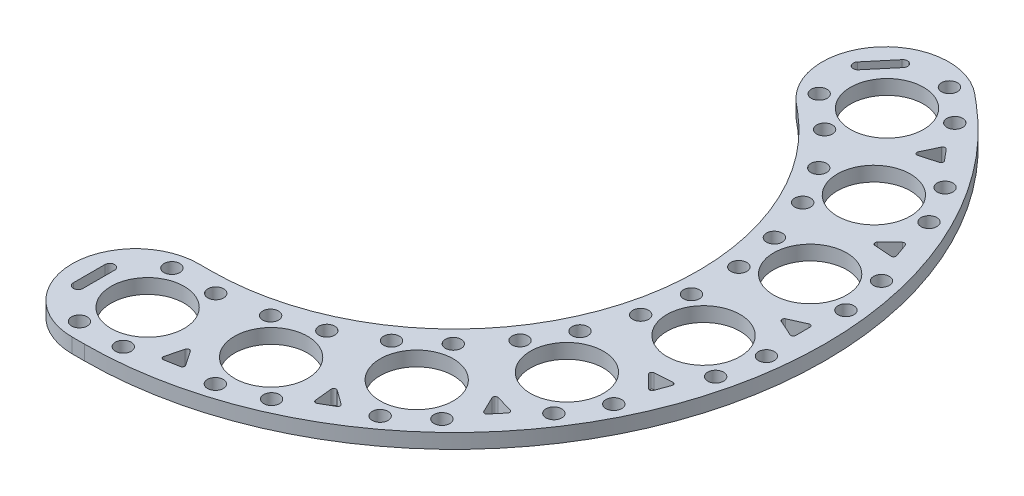
from build123d import *

# Parameters (mm, degrees)
SKETCH1_R           = 150
SKETCH1_R_2         = 32.5
BOSS_EXTRUDE1_DEPTH = 60


with BuildPart() as part:
    # Sketch1 → Boss-Extrude1 (new body)
    with BuildSketch(Plane(origin=(0, 0, 0), x_dir=(1, 0, 0), z_dir=(0, 1, 0))):
        with BuildLine():
            Line((642.787609687, 766.044443119), (604.485387531, 798.183823603))
            ThreePointArc((604.485387531, 798.183823603), (572.438610838, 1164.480157333), (938.734944568, 1196.526934025))
            Line((938.734944568, 1196.526934025), (977.037166724, 1164.387553541))
            ThreePointArc((977.037166724, 1164.387553541), (1428.332783595, -519.870617855), (0, -1520))
            Line((0, -1520), (-50, -1520))
            ThreePointArc((-50, -1520), (-310, -1260), (-50, -1000))
            Line((-50, -1000), (0, -1000))
            ThreePointArc((0, -1000), (939.692620786, -342.020143326), (642.787609687, 766.044443119))
        make_face()
        with Locations(Location((0, -1260, 0), (0, 0, 270))):
            Circle(SKETCH1_R, mode=Mode.SUBTRACT)
        with Locations(Location((90, -1070.26334039, 0), (0, 0, 270))):
            Circle(SKETCH1_R_2, mode=Mode.SUBTRACT)
        with Locations(Location((-90, -1070.26334039, 0), (0, 0, 90))):
            Circle(SKETCH1_R_2, mode=Mode.SUBTRACT)
        with Locations(Location((-90, -1449.73665961, 0), (0, 0, 270))):
            Circle(SKETCH1_R_2, mode=Mode.SUBTRACT)
        with Locations(Location((90, -1449.73665961, 0), (0, 0, 90))):
            Circle(SKETCH1_R_2, mode=Mode.SUBTRACT)
        with Locations(Location((450.623956947, -974.936750363, 0), (0, 0, 270))):
            Circle(SKETCH1_R_2, mode=Mode.SUBTRACT)
        with Locations(Location((430.94538059, -1184.01270219, 0), (0, 0, 270))):
            Circle(SKETCH1_R, mode=Mode.SUBTRACT)
        with Locations(Location((281.479285206, -1036.500376161, 0), (0, 0, 90))):
            Circle(SKETCH1_R_2, mode=Mode.SUBTRACT)
        with Locations(Location((580.411475975, -1331.525028219, 0), (0, 0, 90))):
            Circle(SKETCH1_R_2, mode=Mode.SUBTRACT)
        with Locations(Location((411.266804234, -1393.088654018, 0), (0, 0, 270))):
            Circle(SKETCH1_R_2, mode=Mode.SUBTRACT)
        with Locations(Location((756.896014185, -762.018399708, 0), (0, 0, 270))):
            Circle(SKETCH1_R_2, mode=Mode.SUBTRACT)
        with Locations(Location((809.912388205, -965.21599833, 0), (0, 0, 270))):
            Circle(SKETCH1_R, mode=Mode.SUBTRACT)
        with Locations(Location((619.008014424, -877.720169451, 0), (0, 0, 90))):
            Circle(SKETCH1_R_2, mode=Mode.SUBTRACT)
        with Locations(Location((1000.816761986, -1052.711827208, 0), (0, 0, 90))):
            Circle(SKETCH1_R_2, mode=Mode.SUBTRACT)
        with Locations(Location((862.928762225, -1168.413596952, 0), (0, 0, 270))):
            Circle(SKETCH1_R_2, mode=Mode.SUBTRACT)
        with Locations(Location((971.875241517, -457.189383854, 0), (0, 0, 270))):
            Circle(SKETCH1_R_2, mode=Mode.SUBTRACT)
        with Locations(Location((1091.192008768, -630, 0), (0, 0, 270))):
            Circle(SKETCH1_R, mode=Mode.SUBTRACT)
        with Locations(Location((881.875241517, -613.073956536, 0), (0, 0, 90))):
            Circle(SKETCH1_R_2, mode=Mode.SUBTRACT)
        with Locations(Location((1300.50877602, -646.926043464, 0), (0, 0, 90))):
            Circle(SKETCH1_R_2, mode=Mode.SUBTRACT)
        with Locations(Location((1210.50877602, -802.810616146, 0), (0, 0, 270))):
            Circle(SKETCH1_R_2, mode=Mode.SUBTRACT)
        with Locations(Location((1069.631971371, -97.216580911, 0), (0, 0, 270))):
            Circle(SKETCH1_R_2, mode=Mode.SUBTRACT)
        with Locations(Location((1240.857768795, -218.79670386, 0), (0, 0, 270))):
            Circle(SKETCH1_R, mode=Mode.SUBTRACT)
        with Locations(Location((1038.375299391, -274.481976454, 0), (0, 0, 90))):
            Circle(SKETCH1_R_2, mode=Mode.SUBTRACT)
        with Locations(Location((1443.3402382, -163.111431267, 0), (0, 0, 90))):
            Circle(SKETCH1_R_2, mode=Mode.SUBTRACT)
        with Locations(Location((1412.08356622, -340.376826809, 0), (0, 0, 270))):
            Circle(SKETCH1_R_2, mode=Mode.SUBTRACT)
        with Locations(Location((1038.375299391, 274.481976454, 0), (0, 0, 270))):
            Circle(SKETCH1_R_2, mode=Mode.SUBTRACT)
        with Locations(Location((1240.857768795, 218.79670386, 0), (0, 0, 270))):
            Circle(SKETCH1_R, mode=Mode.SUBTRACT)
        with Locations(Location((1069.631971371, 97.216580911, 0), (0, 0, 90))):
            Circle(SKETCH1_R_2, mode=Mode.SUBTRACT)
        with Locations(Location((1412.08356622, 340.376826809, 0), (0, 0, 90))):
            Circle(SKETCH1_R_2, mode=Mode.SUBTRACT)
        with Locations(Location((1443.3402382, 163.111431267, 0), (0, 0, 270))):
            Circle(SKETCH1_R_2, mode=Mode.SUBTRACT)
        with Locations(Location((881.875241517, 613.073956536, 0), (0, 0, 270))):
            Circle(SKETCH1_R_2, mode=Mode.SUBTRACT)
        with Locations(Location((1091.192008768, 630, 0), (0, 0, 270))):
            Circle(SKETCH1_R, mode=Mode.SUBTRACT)
        with Locations(Location((971.875241517, 457.189383854, 0), (0, 0, 90))):
            Circle(SKETCH1_R_2, mode=Mode.SUBTRACT)
        with Locations(Location((1210.50877602, 802.810616146, 0), (0, 0, 90))):
            Circle(SKETCH1_R_2, mode=Mode.SUBTRACT)
        with Locations(Location((1300.50877602, 646.926043464, 0), (0, 0, 270))):
            Circle(SKETCH1_R_2, mode=Mode.SUBTRACT)
        with Locations(Location((619.008014424, 877.720169451, 0), (0, 0, 270))):
            Circle(SKETCH1_R_2, mode=Mode.SUBTRACT)
        with Locations(Location((809.912388205, 965.21599833, 0), (0, 0, 270))):
            Circle(SKETCH1_R, mode=Mode.SUBTRACT)
        with Locations(Location((756.896014185, 762.018399708, 0), (0, 0, 90))):
            Circle(SKETCH1_R_2, mode=Mode.SUBTRACT)
        with Locations(Location((862.928762225, 1168.413596952, 0), (0, 0, 90))):
            Circle(SKETCH1_R_2, mode=Mode.SUBTRACT)
        with Locations(Location((1000.816761986, 1052.711827208, 0), (0, 0, 270))):
            Circle(SKETCH1_R_2, mode=Mode.SUBTRACT)
        with BuildLine():
            Line((584.280527227, 1069.692135852), (667.842916486, 1169.277913457))
            ThreePointArc((667.842916486, 1169.277913457), (696.019557542, 1171.743050126), (698.484694211, 1143.56640907))
            Line((698.484694211, 1143.56640907), (614.922304952, 1043.980631464))
            ThreePointArc((614.922304952, 1043.980631464), (586.745663896, 1041.515494796), (584.280527227, 1069.692135852))
        make_face(mode=Mode.SUBTRACT)
        with BuildLine():
            Line((-200, -1195), (-200, -1325))
            ThreePointArc((-200, -1325), (-220, -1345), (-240, -1325))
            Line((-240, -1325), (-240, -1195))
            ThreePointArc((-240, -1195), (-220, -1175), (-200, -1195))
        make_face(mode=Mode.SUBTRACT)
        with BuildLine():
            Line((1076.459371898, 941.810748669), (1114.427735422, 896.561815035))
            ThreePointArc((1114.427735422, 896.561815035), (1116.324508918, 887.191221571), (1109.485433629, 880.510441621))
            Line((1109.485433629, 880.510441621), (1040.22465894, 860.947837857))
            ThreePointArc((1040.22465894, 860.947837857), (1029.846071871, 864.143459076), (1028.50122205, 874.919285889))
            Line((1028.50122205, 874.919285889), (1059.793633215, 939.730823288))
            ThreePointArc((1059.793633215, 939.730823288), (1067.560510066, 945.305892392), (1076.459371898, 941.810748669))
        make_face(mode=Mode.SUBTRACT)
        with BuildLine():
            Line((1265.715028387, 470.387061357), (1317.287127556, 520.587349841))
            ThreePointArc((1317.287127556, 520.587349841), (1326.492390354, 523.169772804), (1333.659175594, 516.84182204))
            Line((1333.659175594, 516.84182204), (1353.861719854, 461.335787871))
            ThreePointArc((1353.861719854, 461.335787871), (1352.439172191, 451.881575599), (1343.727582294, 447.942797489))
            Line((1343.727582294, 447.942797489), (1271.952938865, 453.248543174))
            ThreePointArc((1271.952938865, 453.248543174), (1263.29322401, 459.80113069), (1265.715028387, 470.387061357))
        make_face(mode=Mode.SUBTRACT)
        with BuildLine():
            Line((1350.264922337, 9.119215052), (1415.896353227, 38.653358952))
            ThreePointArc((1415.896353227, 38.653358952), (1425.429711423, 37.931657453), (1430, 29.5341439))
            Line((1430, 29.5341439), (1430, -29.5341439))
            ThreePointArc((1430, -29.5341439), (1425.429711423, -37.931657453), (1415.896353227, -38.653358952))
            Line((1415.896353227, -38.653358952), (1350.264922337, -9.119215052))
            ThreePointArc((1350.264922337, -9.119215052), (1344.368569111, 0), (1350.264922337, 9.119215052))
        make_face(mode=Mode.SUBTRACT)
        with BuildLine():
            Line((1271.952938865, -453.248543174), (1343.727582294, -447.942797489))
            ThreePointArc((1343.727582294, -447.942797489), (1352.439172192, -451.881575599), (1353.861719854, -461.335787871))
            Line((1353.861719854, -461.335787871), (1333.659175594, -516.84182204))
            ThreePointArc((1333.659175594, -516.84182204), (1326.492390354, -523.169772804), (1317.287127556, -520.587349841))
            Line((1317.287127556, -520.587349841), (1265.715028387, -470.387061357))
            ThreePointArc((1265.715028387, -470.387061357), (1263.29322401, -459.80113069), (1271.952938865, -453.248543174))
        make_face(mode=Mode.SUBTRACT)
        with BuildLine():
            Line((1040.22465894, -860.947837857), (1109.485433629, -880.510441621))
            ThreePointArc((1109.485433629, -880.510441621), (1116.324508918, -887.191221571), (1114.427735422, -896.561815035))
            Line((1114.427735422, -896.561815035), (1076.459371898, -941.810748669))
            ThreePointArc((1076.459371898, -941.810748669), (1067.560510067, -945.305892392), (1059.793633215, -939.730823288))
            Line((1059.793633215, -939.730823288), (1028.50122205, -874.919285889))
            ThreePointArc((1028.50122205, -874.919285889), (1029.846071871, -864.143459076), (1040.22465894, -860.947837857))
        make_face(mode=Mode.SUBTRACT)
        with BuildLine():
            Line((683.029933066, -1164.804117057), (741.422967407, -1206.875531544))
            ThreePointArc((741.422967407, -1206.875531544), (745.564634673, -1215.492512675), (740.577318897, -1223.649255462))
            Line((740.577318897, -1223.649255462), (689.422681103, -1253.183399362))
            ThreePointArc((689.422681103, -1253.183399362), (679.86507675, -1253.424170128), (674.473385819, -1245.528890496))
            Line((674.473385819, -1245.528890496), (667.234989271, -1173.923332109))
            ThreePointArc((667.234989271, -1173.923332109), (672.184284555, -1164.257332899), (683.029933066, -1164.804117057))
        make_face(mode=Mode.SUBTRACT)
        with BuildLine():
            Line((243.451716816, -1328.167829063), (283.933949079, -1387.673620777))
            ThreePointArc((283.933949079, -1387.673620777), (284.878662125, -1397.18746799), (277.402347955, -1403.14653654))
            Line((277.402347955, -1403.14653654), (219.231440172, -1413.403637075))
            ThreePointArc((219.231440172, -1413.403637075), (210.167881437, -1410.360994376), (207.801693927, -1401.097791462))
            Line((207.801693927, -1401.097791462), (225.490369447, -1331.334899214))
            ThreePointArc((225.490369447, -1331.334899214), (233.447152139, -1323.944589766), (243.451716816, -1328.167829063))
        make_face(mode=Mode.SUBTRACT)
    extrude(amount=BOSS_EXTRUDE1_DEPTH)


solid = part.part
